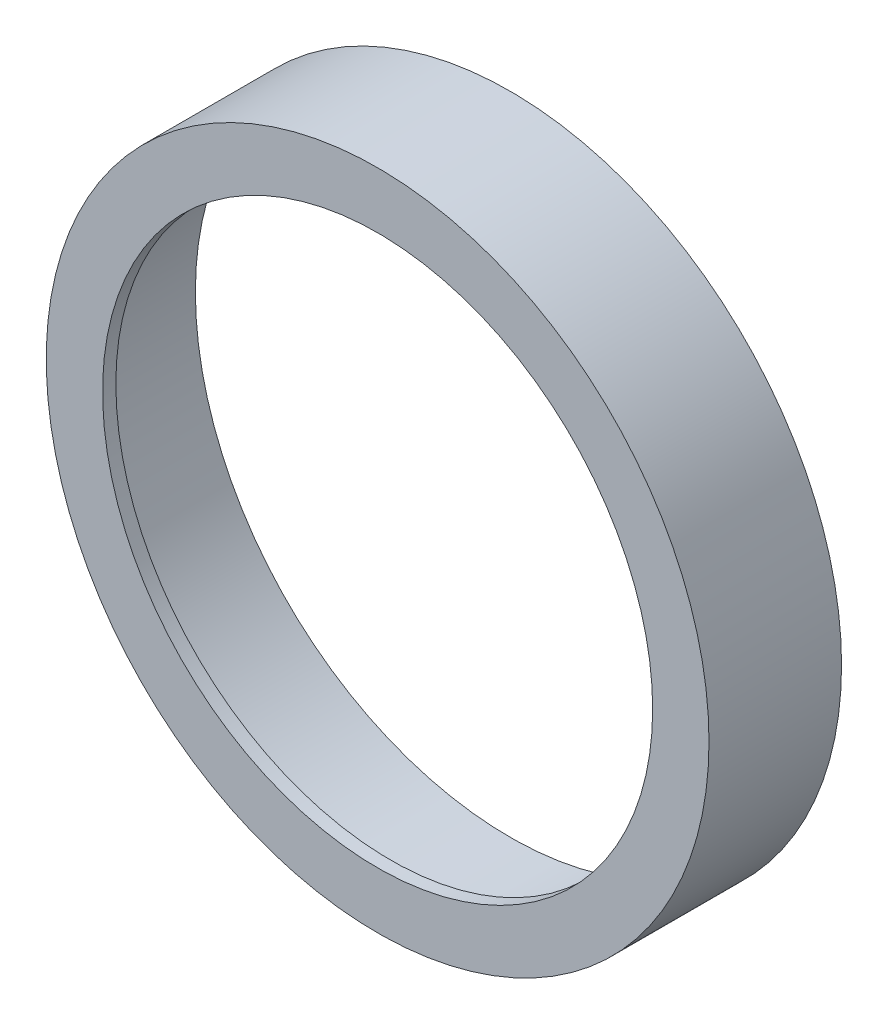
from build123d import *

# Parameters (mm, degrees)
SKETCH_1_R          = 5
EXTRUDE_1_DEPTH     = 2
SKETCH_2_R          = 4.15
CUT_EXTRUDE_1_DEPTH = 1.8
SKETCH_3_R          = 4.75
CUT_EXTRUDE_2_DEPTH = 1.8


with BuildPart() as part:
    # 草图1 → 凸台-拉伸1 (new body)
    with BuildSketch(Plane.XY):
        Circle(SKETCH_1_R)
    extrude(amount=EXTRUDE_1_DEPTH)

    # 草图2 → 切除-拉伸1 (cut)
    with BuildSketch(Plane.XY.offset(2)):
        Circle(SKETCH_2_R)
    extrude(amount=-CUT_EXTRUDE_1_DEPTH, mode=Mode.SUBTRACT)

    # 草图3 → 切除-拉伸2 (cut)
    with BuildSketch(Plane(origin=(0, 0, 0), x_dir=(-1, 0, 0), z_dir=(0, 0, -1))):
        Circle(SKETCH_3_R)
    extrude(amount=-CUT_EXTRUDE_2_DEPTH, mode=Mode.SUBTRACT)


solid = part.part
